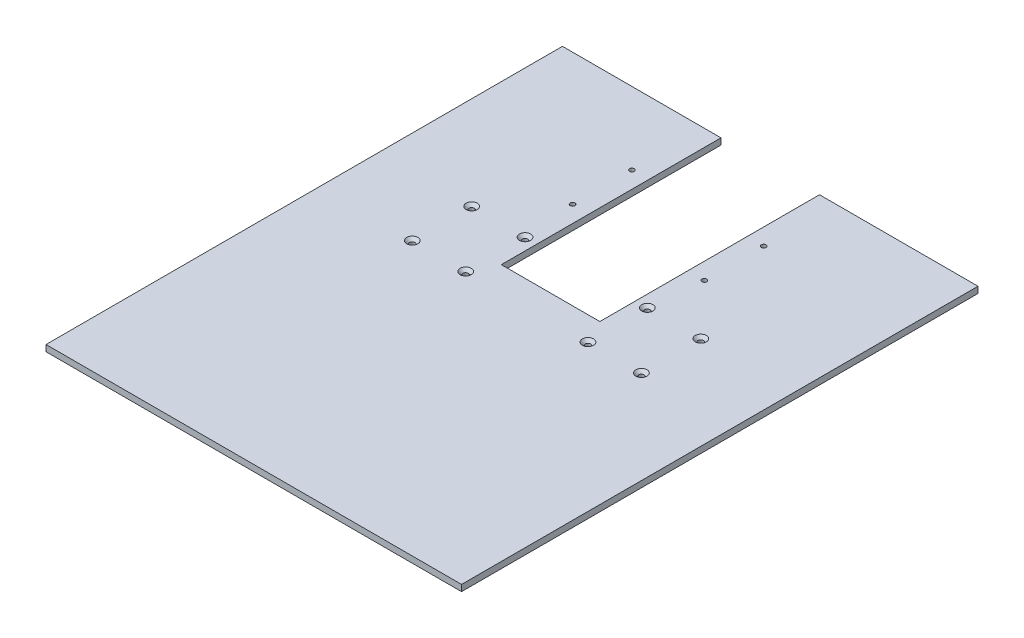
from build123d import *

# Parameters (mm, degrees)
SKETCH1_W                                       = 350
SKETCH1_H                                       = 250
BOSS_EXTRUDE1_DEPTH                             = 5.3
SKETCH4_W                                       = 133.5
SKETCH4_H                                       = 5.3
BOSS_EXTRUDE3_DEPTH                             = 185
F_4_0MM_DOWEL_HOLE1_D                           = 4
CSK_FOR_M4_FLAT_HEAD_MACHINE_SCREW2_D           = 4.5
CSK_FOR_M4_FLAT_HEAD_MACHINE_SCREW2_CSINK_D     = 9.4
CSK_FOR_M4_FLAT_HEAD_MACHINE_SCREW2_CSINK_ANGLE = 90


with BuildPart() as part:
    # Sketch1 → Boss-Extrude1 (new body)
    with BuildSketch(Plane(origin=(0, 0, 0), x_dir=(1, 0, 0), z_dir=(0, 1, 0))):
        with Locations((-85.330578512, -202.479338843)):
            Rectangle(SKETCH1_W, SKETCH1_H)
    extrude(amount=BOSS_EXTRUDE1_DEPTH)

    # Sketch4 → Boss-Extrude3 (add)
    with BuildSketch(Plane(origin=(0, 0, 77.479338843), x_dir=(-1, 0, 0), z_dir=(0, 0, -1))):
        with Locations((193.580578512, 2.65)):
            Rectangle(SKETCH4_W, SKETCH4_H)
        with Locations((-22.919421488, 2.65)):
            Rectangle(SKETCH4_W, SKETCH4_H)
    extrude(amount=BOSS_EXTRUDE3_DEPTH)

    # Ø4.0mm Dowel Hole1 (through all)
    with Locations(Plane(origin=(0, 5.3, 0), x_dir=(1, 0, 0), z_dir=(0, 1, 0))):
        with Locations((-181.830578512, -47.479338843), (-181.830578512, -97.479338843), (-136.830578512, -97.479338843), (-136.830578512, -47.479338843), (-33.830578512, -47.479338843), (11.169421488, -47.479338843), (11.169421488, -97.479338843), (-33.830578512, -97.479338843), (-29.830578512, -3.479338843), (-29.830578512, 46.520661157), (-140.830578512, 46.520661157), (-140.830578512, -3.479338843)):
            Hole(F_4_0MM_DOWEL_HOLE1_D / 2)

    # CSK for M4 Flat Head Machine Screw2 (through all)
    with Locations(Plane(origin=(0, 5.3, 0), x_dir=(1, 0, 0), z_dir=(0, 1, 0))):
        with Locations((-181.830578512, -47.479338843), (-136.830578512, -47.479338843), (-181.830578512, -97.479338843), (-136.830578512, -97.479338843), (-33.830578512, -47.479338843), (11.169421488, -47.479338843), (11.169421488, -97.479338843), (-33.830578512, -97.479338843)):
            CounterSinkHole(CSK_FOR_M4_FLAT_HEAD_MACHINE_SCREW2_D / 2, CSK_FOR_M4_FLAT_HEAD_MACHINE_SCREW2_CSINK_D / 2, counter_sink_angle=CSK_FOR_M4_FLAT_HEAD_MACHINE_SCREW2_CSINK_ANGLE)


solid = part.part
